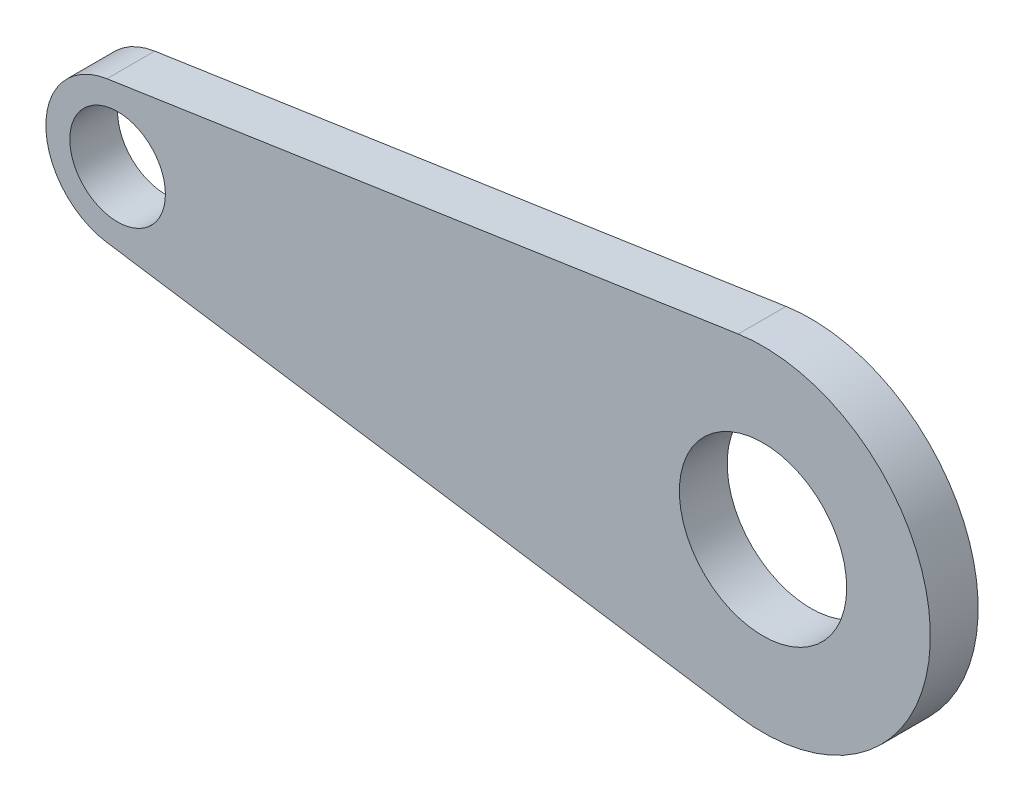
from build123d import *

# Parameters (mm, degrees)
SKETCH_1_R        = 1
SKETCH_1_R_2      = 1.75
EXTRUDE_474_DEPTH = 1


with BuildPart() as part:
    # Эскиз1 → Extrude 474 (new body)
    with BuildSketch(Plane.XY):
        with BuildLine():
            Line((-0.222222222, 1.483447769), (12.981481481, 3.461378128))
            ThreePointArc((12.981481481, 3.461378128), (17, 0), (12.981481481, -3.461378128))
            Line((12.981481481, -3.461378128), (-0.222222222, -1.483447769))
            ThreePointArc((-0.222222222, -1.483447769), (-1.5, 0), (-0.222222222, 1.483447769))
        make_face()
        Circle(SKETCH_1_R, mode=Mode.SUBTRACT)
        with Locations((13.5, 0)):
            Circle(SKETCH_1_R_2, mode=Mode.SUBTRACT)
    extrude(amount=EXTRUDE_474_DEPTH)


solid = part.part
